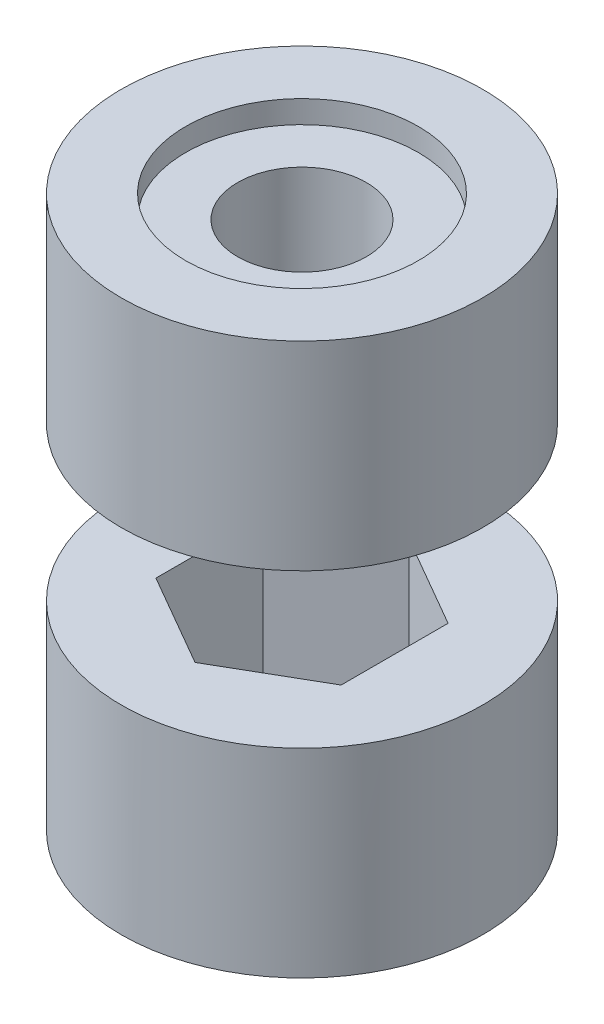
from build123d import *

# Parameters (mm, degrees)
SKETCH1_R               = 8
BOSS_EXTRUDE1_DEPTH     = 24.418
CUT_EXTRUDE1_DEPTH      = 27.911683782
CUT_EXTRUDE1_DEPTH_BACK = 27.911683782
SKETCH2_W               = 20.4
SKETCH2_H               = 6.8
SKETCH3_R               = 2.85
CUT_EXTRUDE2_DEPTH      = 24.418
SKETCH4_R               = 5.15
CUT_EXTRUDE3_DEPTH      = 1
CUT_EXTRUDE4_DEPTH      = 9


with BuildPart() as part:
    # Sketch1 → Boss-Extrude1 (new body)
    with BuildSketch(Plane(origin=(0, 0, 0), x_dir=(1, 0, 0), z_dir=(0, 1, 0))):
        with Locations(Location((0, 0, 0), (0, 0, 270))):
            Circle(SKETCH1_R)
    extrude(amount=BOSS_EXTRUDE1_DEPTH)

    # Sketch2 → Cut-Extrude1 (cut, two sides: drawn at the far end of the back side and taken through both)
    with BuildSketch(Plane.XY.offset(-CUT_EXTRUDE1_DEPTH_BACK)):
        with Locations((0, 12.209)):
            Rectangle(SKETCH2_W, SKETCH2_H)
    extrude(amount=CUT_EXTRUDE1_DEPTH + CUT_EXTRUDE1_DEPTH_BACK, mode=Mode.SUBTRACT)


with BuildPart() as cut_extrude1_piece_1:
    # of the separate pieces the step leaves, piece 1, a body of its own (cut_extrude1_pieces)
    add(part.part.solids().sort_by_distance((0, 0, 8))[0])


with BuildPart() as cut_extrude1_piece_2:
    # of the separate pieces the step leaves, piece 2, a body of its own (cut_extrude1_pieces)
    add(part.part.solids().sort_by_distance((0, 15.609, 8))[0])


with BuildPart() as cut_extrude2_tool:
    # Sketch3 → Cut-Extrude2 (new body)
    with BuildSketch(Plane(origin=(0, 0, 0), x_dir=(1, 0, 0), z_dir=(0, 1, 0))):
        with Locations(Location((0, 0, 0), (0, 0, 270))):
            Circle(SKETCH3_R)
    extrude(amount=CUT_EXTRUDE2_DEPTH)


with BuildPart() as cut_extrude1_piece_1_1:
    add(cut_extrude1_piece_1.part)

    # Cut-Extrude2: cut by cut_extrude2_tool
    add(cut_extrude2_tool.part, mode=Mode.SUBTRACT)

    # Sketch5 → Cut-Extrude4 (cut)
    with BuildSketch(Plane(origin=(0, 0, 0), x_dir=(1, 0, 0), z_dir=(0, 1, 0))):
        Polygon((4.1, -2.367136104), (0, -4.734272207), (-4.1, -2.367136104), (-4.1, 2.367136104), (0, 4.734272207), (4.1, 2.367136104), align=None)
    extrude(amount=CUT_EXTRUDE4_DEPTH, mode=Mode.SUBTRACT)


with BuildPart() as cut_extrude1_piece_2_1:
    add(cut_extrude1_piece_2.part)

    # Cut-Extrude2: cut by cut_extrude2_tool
    add(cut_extrude2_tool.part, mode=Mode.SUBTRACT)

    # Sketch4 → Cut-Extrude3 (cut)
    with BuildSketch(Plane(origin=(0, 24.418, 0), x_dir=(1, 0, 0), z_dir=(0, 1, 0))):
        with Locations(Location((0, 0, 0), (0, 0, 270))):
            Circle(SKETCH4_R)
    extrude(amount=-CUT_EXTRUDE3_DEPTH, mode=Mode.SUBTRACT)


solid = Compound([cut_extrude1_piece_1_1.part, cut_extrude1_piece_2_1.part])
